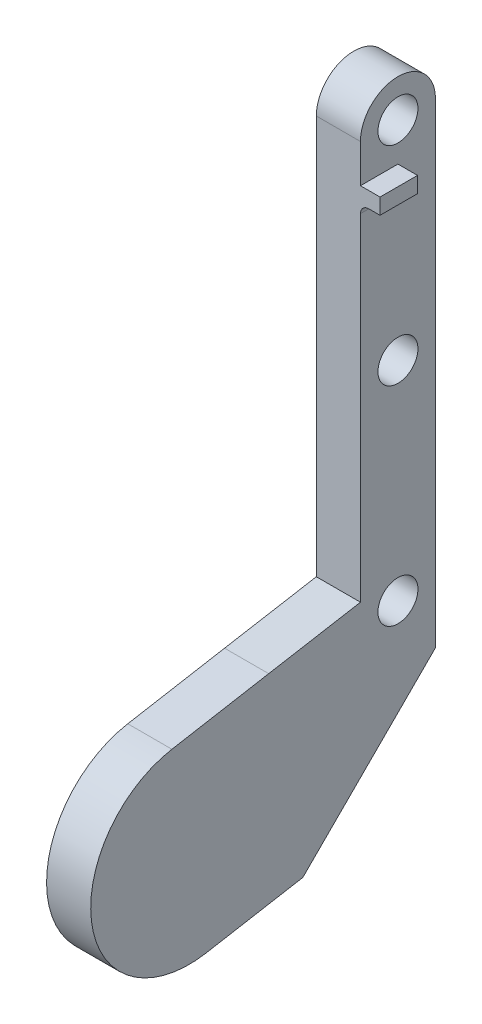
from build123d import *

# Parameters (mm, degrees)
SKETCH1_R           = 2.5
BOSS_EXTRUDE1_DEPTH = 2.65
SKETCH1_5_W         = 4.5
SKETCH1_5_H         = 2
BOSS_EXTRUDE2_DEPTH = 5
FILLET1_R           = 1
MOVE_FACE1_BY       = 0.1
MOVE_FACE1_2_BY     = 0.1
MOVE_FACE1_3_BY     = 0.1
MOVE_FACE2_BY       = 0.1


with BuildPart() as part:
    # Sketch1 → Boss-Extrude1 (new, symmetric)
    with BuildSketch(Plane(origin=(0, 0, 0), x_dir=(0, 0, -1), z_dir=(1, 0, 0))):
        with BuildLine():
            Line((2.049048496, -11.620731486), (13.669779982, -9.571682989))
            Line((13.669779982, -9.571682989), (29.59, 6.348537029))
            Line((29.59, 6.348537029), (29.59, 63.5))
            ThreePointArc((29.59, 63.5), (25.09, 68), (20.59, 63.5))
            Line((20.59, 63.5), (20.59, 15.59029712))
            Line((20.59, 15.59029712), (9.571682989, 13.669779982))
            Line((9.571682989, 13.669779982), (-2.049048496, 11.620731486))
            ThreePointArc((-2.049048496, 11.620731486), (-11.620731486, -2.049048496), (2.049048496, -11.620731486))
        make_face()
        with Locations((25.09, 63.5)):
            Circle(SKETCH1_R, mode=Mode.SUBTRACT)
        with Locations((25.09, 13.5)):
            Circle(SKETCH1_R, mode=Mode.SUBTRACT)
        with Locations((25.09, 38.5)):
            Circle(SKETCH1_R, mode=Mode.SUBTRACT)
    extrude(amount=BOSS_EXTRUDE1_DEPTH, both=True)

    # Sketch1<5> → Boss-Extrude2 (add)
    with BuildSketch(Plane(origin=(0, 0, 0), x_dir=(0, 0, -1), z_dir=(1, 0, 0))):
        with Locations((22.84, 58)):
            Rectangle(SKETCH1_5_W, SKETCH1_5_H)
    extrude(amount=BOSS_EXTRUDE2_DEPTH)

    # Fillet1
    fillet1_edges = [part.edges().sort_by_distance(p)[0] for p in [
        (2.65, 57, -22.84),
    ]]
    fillet(fillet1_edges, radius=FILLET1_R)

    # Move Face1: a curved face moved outward by 0.1
    add(Solid.thicken(part.faces().sort_by_distance((0, 13.5, -22.59))[0], MOVE_FACE1_BY))

    # Move Face1 2: a curved face moved outward by 0.1
    add(Solid.thicken(part.faces().sort_by_distance((0, 38.5, -22.59))[0], MOVE_FACE1_2_BY))

    # Move Face1 3: a curved face moved outward by 0.1
    add(Solid.thicken(part.faces().sort_by_distance((0, 63.5, -22.59))[0], MOVE_FACE1_3_BY))

    # Move Face2: a face moved inward by 0.1
    extrude(part.faces().sort_by_distance((3.825, 59, -22.84))[0], amount=MOVE_FACE2_BY, dir=(0, -1, 0), mode=Mode.SUBTRACT)


solid = part.part
